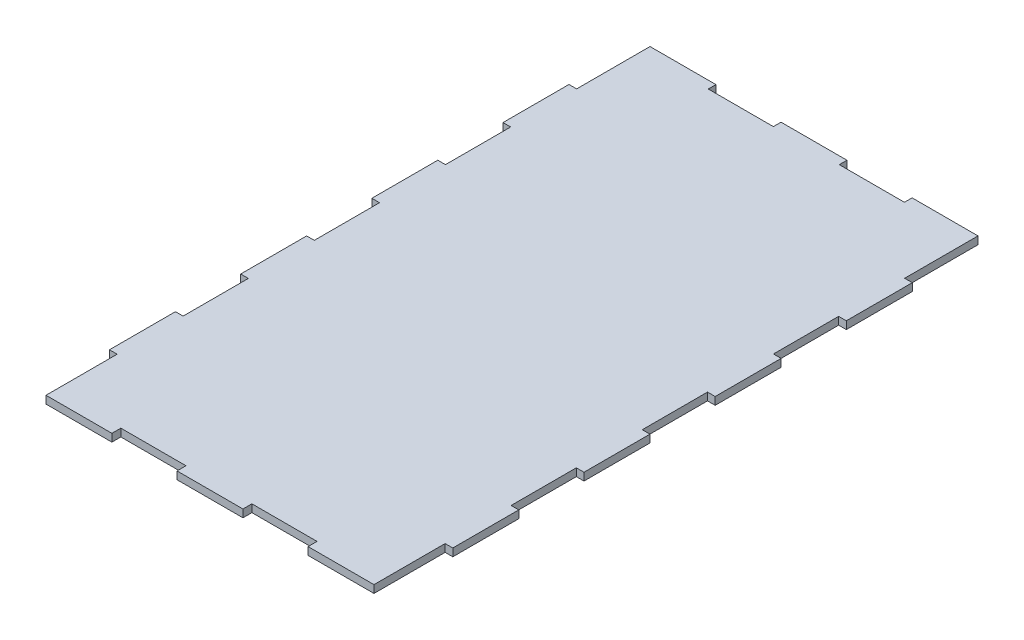
from build123d import *

# Parameters (mm, degrees)
BOSS_EXTRUDE1_DEPTH = 3


with BuildPart() as part:
    # Sketch1 → Boss-Extrude1 (new body)
    with BuildSketch(Plane(origin=(0, 0, 0), x_dir=(1, 0, 0), z_dir=(0, 1, 0))):
        Polygon((-64.15, 204.08), (-64.15, 230.66), (-64.15, 232.78), (-38.37, 232.78), (-38.37, 229.78), (-12.89, 229.78), (-12.89, 232.78), (12.89, 232.78), (12.89, 229.78), (38.37, 229.78), (38.37, 232.78), (64.15, 232.78), (64.15, 230.66), (64.15, 204.08), (67.15, 204.08), (67.15, 178.27375), (64.15, 178.27375), (64.15, 152.7675), (67.15, 152.7675), (67.15, 126.96125), (64.15, 126.96125), (64.15, 101.455), (67.15, 101.455), (67.15, 75.64875), (64.15, 75.64875), (64.15, 50.1425), (67.15, 50.1425), (67.15, 24.33625), (64.15, 24.33625), (64.15, -1.17), (64.15, -3.5), (38.37, -3.5), (38.37, 0), (12.89, 0), (12.89, -3.5), (-12.89, -3.5), (-12.89, 0), (-38.37, 0), (-38.37, -3.5), (-64.15, -3.5), (-64.15, -1.17), (-64.15, 24.33625), (-67.15, 24.33625), (-67.15, 50.1425), (-64.15, 50.1425), (-64.15, 75.64875), (-67.15, 75.64875), (-67.15, 101.455), (-64.15, 101.455), (-64.15, 126.96125), (-67.15, 126.96125), (-67.15, 152.7675), (-64.15, 152.7675), (-64.15, 178.27375), (-67.15, 178.27375), (-67.15, 204.08), align=None)
    extrude(amount=BOSS_EXTRUDE1_DEPTH)


solid = part.part
